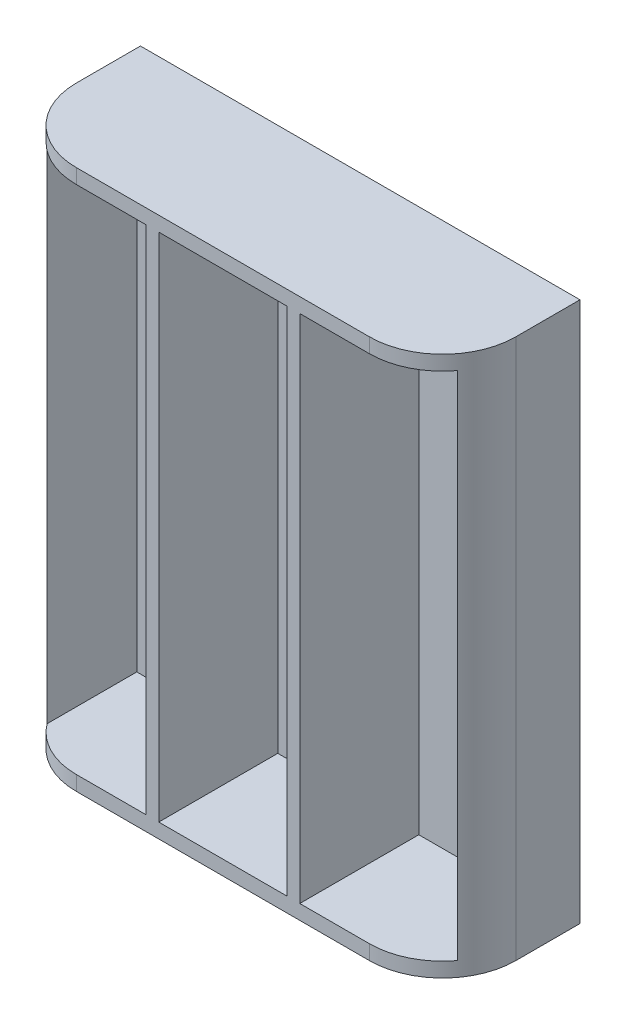
from build123d import *

# Parameters (mm, degrees)
SKETCH1_W           = 48
SKETCH1_H           = 59
BOSS_EXTRUDE1_DEPTH = 2
BOSS_EXTRUDE2_DEPTH = 59
SKETCH3_W           = 14
SKETCH3_H           = 55.8
CUT_EXTRUDE1_DEPTH  = 13


with BuildPart() as part:
    # Sketch1 → Boss-Extrude1 (new body)
    with BuildSketch(Plane.XY):
        Rectangle(SKETCH1_W, SKETCH1_H)
    extrude(amount=BOSS_EXTRUDE1_DEPTH)

    # Sketch2 → Boss-Extrude2 (add)
    with BuildSketch(Plane.XZ.offset(29.5)):
        with BuildLine():
            Line((-16, 15), (16, 15))
            ThreePointArc((16, 15), (21.656854249, 12.656854249), (24, 7))
            Line((24, 7), (24, 2))
            Line((24, 2), (-24, 2))
            Line((-24, 2), (-24, 7))
            ThreePointArc((-24, 7), (-21.656854249, 12.656854249), (-16, 15))
        make_face()
    extrude(amount=-BOSS_EXTRUDE2_DEPTH)

    # Sketch3 → Cut-Extrude1 (cut)
    with BuildSketch(Plane.XY.offset(15)):
        Rectangle(SKETCH3_W, SKETCH3_H)
        with Locations((15.4, 0)):
            Rectangle(SKETCH3_W, SKETCH3_H)
        with Locations((-15.4, 0)):
            Rectangle(SKETCH3_W, SKETCH3_H)
    extrude(amount=-CUT_EXTRUDE1_DEPTH, mode=Mode.SUBTRACT)


solid = part.part
